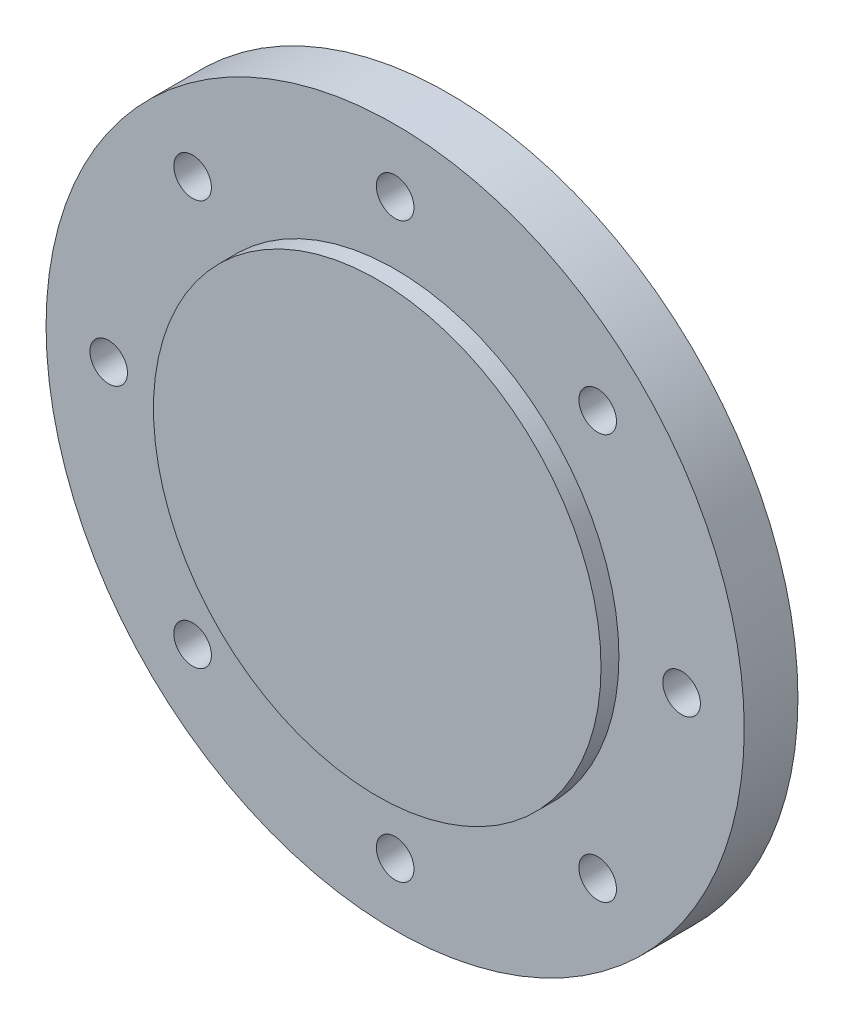
from build123d import *

# Parameters (mm, degrees)
SK_DISC_R                 = 39
OUTPUT_DISC_DEPTH         = 6
SK_PILOT_R                = 25
PILOT_BOSS_DEPTH          = 2
SK_OUTHOLE_R              = 2.1
OUTPUT_TAPPED_HOLE_DEPTH  = 6
OUTPUT_HOLE_PATTERN_COUNT = 8


with BuildPart() as part:
    # SK_Disc → Output_Disc (new body)
    with BuildSketch(Plane.XY):
        Circle(SK_DISC_R)
    extrude(amount=OUTPUT_DISC_DEPTH)

    # SK_Pilot → Pilot_Boss (add)
    with BuildSketch(Plane.XY.offset(6)):
        Circle(SK_PILOT_R)
    extrude(amount=PILOT_BOSS_DEPTH)

    # SK_OutHole → Output_Tapped_Hole (cut)
    with BuildSketch(Plane.XY.offset(6)):
        with Locations((32, 0)):
            Circle(SK_OUTHOLE_R)
    output_tapped_hole = extrude(amount=-OUTPUT_TAPPED_HOLE_DEPTH, mode=Mode.SUBTRACT)

    # Output_Hole_Pattern: Output_Tapped_Hole ×8 about axis
    output_hole_pattern_axis = Axis((0, 0, -0.4), (0, 0, 1))
    for i in range(1, OUTPUT_HOLE_PATTERN_COUNT):
        add(output_tapped_hole.rotate(output_hole_pattern_axis, i * 360 / OUTPUT_HOLE_PATTERN_COUNT), mode=Mode.SUBTRACT)


solid = part.part
